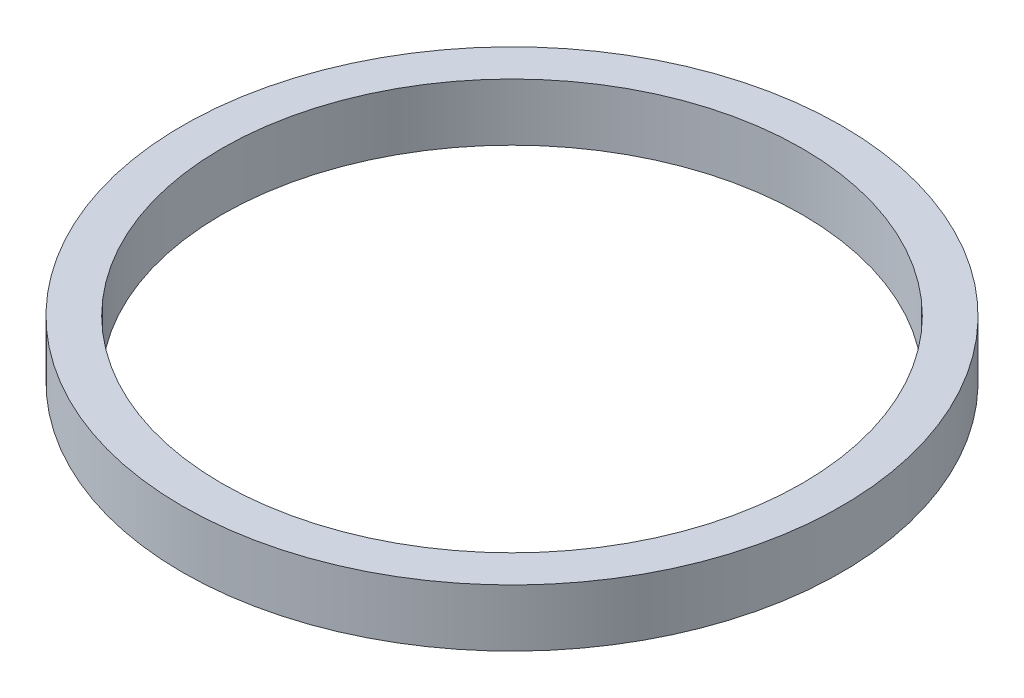
from build123d import *

# Parameters (mm, degrees)
SKETCH1_R           = 23
SKETCH1_R_2         = 20.25
BOSS_EXTRUDE1_DEPTH = 4


with BuildPart() as part:
    # Sketch1 → Boss-Extrude1 (new body)
    with BuildSketch(Plane(origin=(0, 0, 0), x_dir=(1, 0, 0), z_dir=(0, 1, 0))):
        with Locations(Location((0, 0, 0), (0, 0, 270))):
            Circle(SKETCH1_R)
        with Locations(Location((0, 0, 0), (0, 0, 270))):
            Circle(SKETCH1_R_2, mode=Mode.SUBTRACT)
    extrude(amount=BOSS_EXTRUDE1_DEPTH)


solid = part.part
